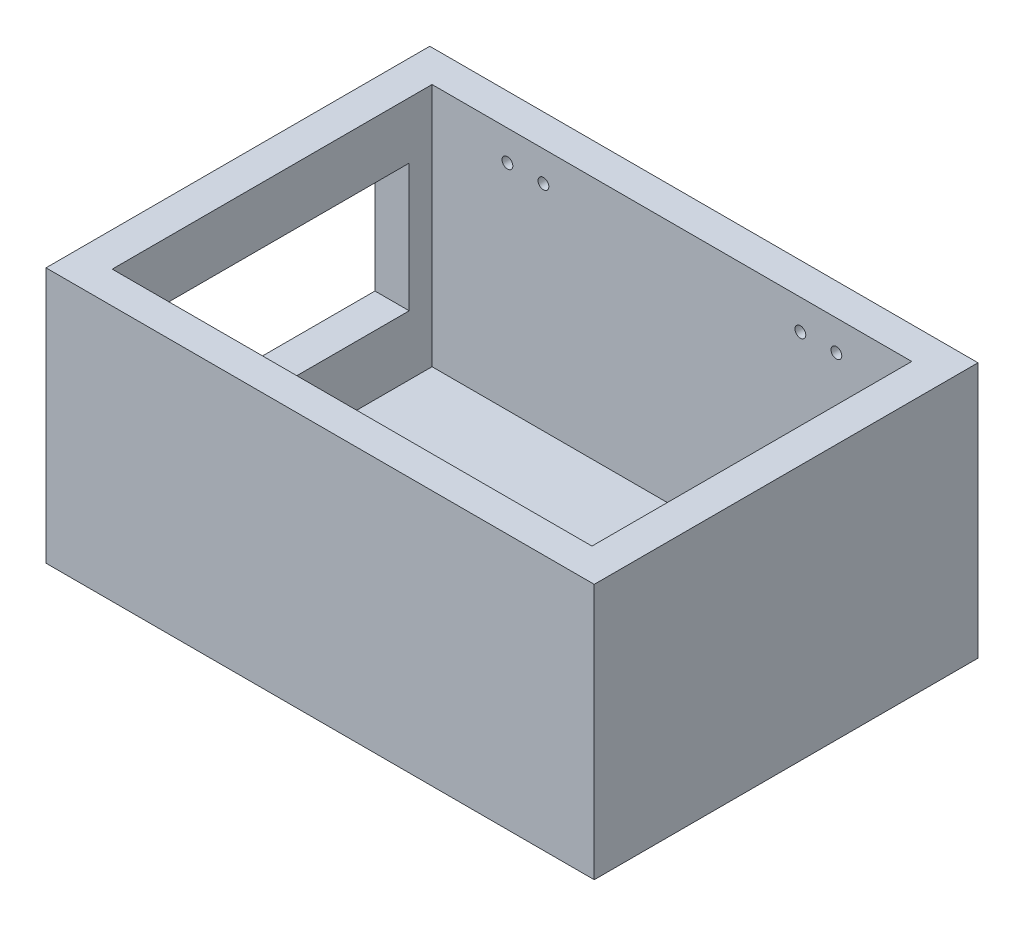
from build123d import *

# Parameters (mm, degrees)
SKETCH2_W                = 152.4
SKETCH2_H                = 106.68
BOSS_EXTRUDE1_DEPTH      = 71.12
SKETCH3_W                = 133.35
SKETCH3_H                = 88.9
CUT_EXTRUDE1_DEPTH       = 67.945
SKETCH8_W                = 5.08
SKETCH8_H                = 24.765
SKETCH8_W_2              = 3.302
SKETCH8_H_2              = 49.53
BOSS_EXTRUDE2_DEPTH      = 17.272
SKETCH12_W               = 76.2
SKETCH12_H               = 35.56
CUT_EXTRUDE3_DEPTH       = 9.525
CUT_EXTRUDE12_DEPTH      = 93.820000066
CUT_EXTRUDE12_DEPTH_BACK = 4.45999997
SKETCH35_R               = 1.4986
SKETCH36_R               = 1.905
CUT_EXTRUDE13_DEPTH      = 2.54
SKETCH37_W               = 11.43
SKETCH37_H               = 11.43
CUT_EXTRUDE14_DEPTH      = 9.525


with BuildPart() as part:
    # Sketch2 → Boss-Extrude1 (new body)
    with BuildSketch(Plane(origin=(0, 0, 0), x_dir=(1, 0, 0), z_dir=(0, 1, 0))):
        with Locations((76.2, -53.34)):
            Rectangle(SKETCH2_W, SKETCH2_H)
    extrude(amount=BOSS_EXTRUDE1_DEPTH)

    # Sketch3 → Cut-Extrude1 (cut)
    with BuildSketch(Plane(origin=(0, 71.12, 0), x_dir=(1, 0, 0), z_dir=(0, 1, 0))):
        with Locations((76.2, -53.34)):
            Rectangle(SKETCH3_W, SKETCH3_H)
    extrude(amount=-CUT_EXTRUDE1_DEPTH, mode=Mode.SUBTRACT)

    # Sketch8 → Boss-Extrude2 (add)
    with BuildSketch(Plane.ZY.offset(-142.875)):
        with Locations((72.898, 40.3225)):
            Rectangle(SKETCH8_W, SKETCH8_H)
        with Locations((72.898, 15.5575)):
            Rectangle(SKETCH8_W, SKETCH8_H)
        with Locations((44.069, 27.94)):
            Rectangle(SKETCH8_W_2, SKETCH8_H_2)
    extrude(amount=BOSS_EXTRUDE2_DEPTH)

    # Sketch12 → Cut-Extrude3 (cut)
    with BuildSketch(Plane.ZY):
        with Locations((53.34, 37.592)):
            Rectangle(SKETCH12_W, SKETCH12_H)
    extrude(amount=-CUT_EXTRUDE3_DEPTH, mode=Mode.SUBTRACT)

    # Sketch35 → Cut-Extrude12 (cut, two sides: drawn at the far end of the back side and taken through both)
    with BuildSketch(Plane.XY.offset(8.89).offset(-CUT_EXTRUDE12_DEPTH_BACK)):
        with Locations(Location((30.48, 62.738, 0), (0, 0, 180))):
            Circle(SKETCH35_R)
        with Locations(Location((40.4876, 62.738, 0), (0, 0, 180))):
            Circle(SKETCH35_R)
        with Locations(Location((111.9124, 62.738, 0), (0, 0, 180))):
            Circle(SKETCH35_R)
        with Locations(Location((121.92, 62.738, 0), (0, 0, 180))):
            Circle(SKETCH35_R)
    extrude(amount=CUT_EXTRUDE12_DEPTH + CUT_EXTRUDE12_DEPTH_BACK, mode=Mode.SUBTRACT)

    # Sketch36 → Cut-Extrude13 (cut)
    with BuildSketch(Plane.ZY):
        with Locations((53.34, 63.221423834)):
            Circle(SKETCH36_R)
    extrude(amount=-CUT_EXTRUDE13_DEPTH, mode=Mode.SUBTRACT)

    # Sketch37 → Cut-Extrude14 (cut)
    with BuildSketch(Plane.ZY):
        with Locations((73.025, 11.557)):
            Rectangle(SKETCH37_W, SKETCH37_H)
    extrude(amount=-CUT_EXTRUDE14_DEPTH, mode=Mode.SUBTRACT)


solid = part.part
